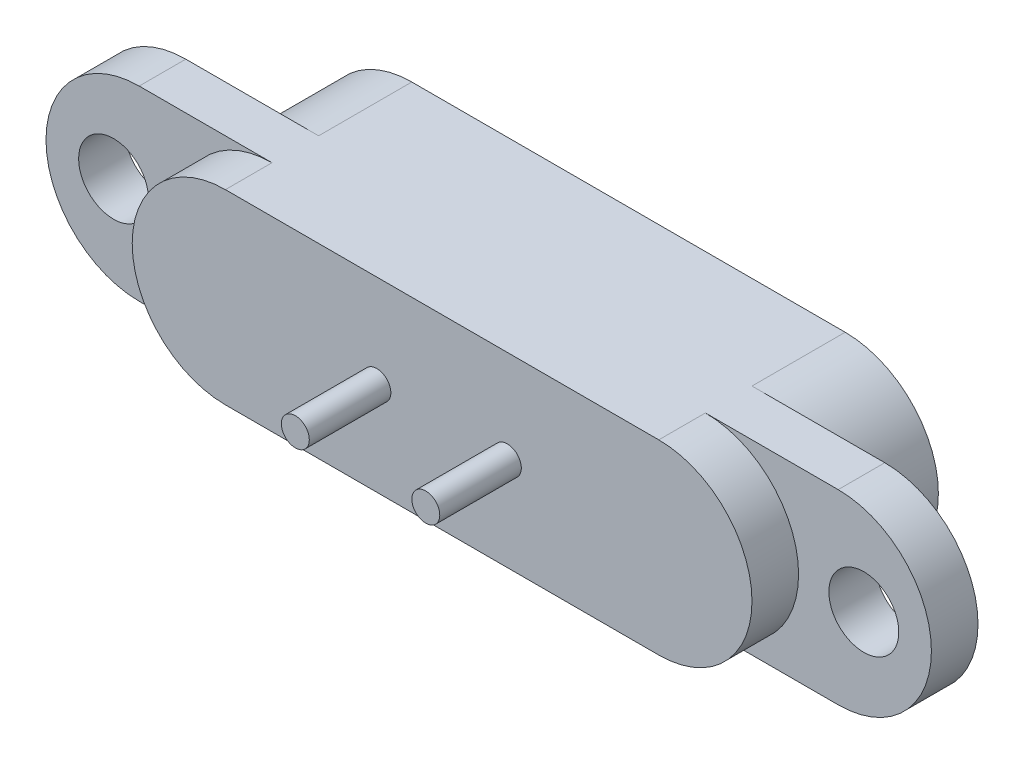
from build123d import *

# Parameters (mm, degrees)
EXTRUDE_1_DEPTH     = 4
EXTRUDE_START       = -2
SKETCH_2_R          = 0.75
EXTRUDE_2_DEPTH     = 1
SKETCH_3_R          = 0.75
CUT_EXTRUDE_1_DEPTH = 0.1
SKETCH_4_R          = 0.3
EXTRUDE_3_DEPTH     = 1.75


with BuildPart() as part:
    # 草图1 → 凸台-拉伸1 (new body)
    with BuildSketch(Plane.XY):
        with BuildLine():
            Line((0, 2), (9.3, 2))
            ThreePointArc((9.3, 2), (11.3, 0), (9.3, -2))
            Line((9.3, -2), (0, -2))
            ThreePointArc((0, -2), (-2, 0), (0, 2))
        make_face()
    extrude(amount=EXTRUDE_1_DEPTH)

    # 草图2 → 凸台-拉伸2 (add)
    with BuildSketch(Plane(origin=(0, 0, 0), x_dir=(-1, 0, 0), z_dir=(0, 0, -1)).offset(EXTRUDE_START)):
        with BuildLine():
            Line((-12.15, 2), (2.85, 2))
            ThreePointArc((2.85, 2), (4.85, 0), (2.85, -2))
            Line((2.85, -2), (-12.15, -2))
            ThreePointArc((-12.15, -2), (-14.15, 0), (-12.15, 2))
        make_face()
        with Locations((-12.7, 0)):
            Circle(SKETCH_2_R, mode=Mode.SUBTRACT)
        with Locations((3.4, 0)):
            Circle(SKETCH_2_R, mode=Mode.SUBTRACT)
    extrude(amount=-EXTRUDE_2_DEPTH)

    # 草图3 → 切除-拉伸1 (cut)
    with BuildSketch(Plane(origin=(0, 0, 0), x_dir=(-1, 0, 0), z_dir=(0, 0, -1))):
        with Locations((-6.05, 0)):
            Circle(SKETCH_3_R)
        with Locations((-3.25, 0)):
            Circle(SKETCH_3_R)
    extrude(amount=-CUT_EXTRUDE_1_DEPTH, mode=Mode.SUBTRACT)

    # 草图4 → 凸台-拉伸3 (add)
    with BuildSketch(Plane.XY.offset(4)):
        with Locations((3.25, 0)):
            Circle(SKETCH_4_R)
        with Locations((6.05, 0)):
            Circle(SKETCH_4_R)
    extrude(amount=EXTRUDE_3_DEPTH)


solid = part.part
